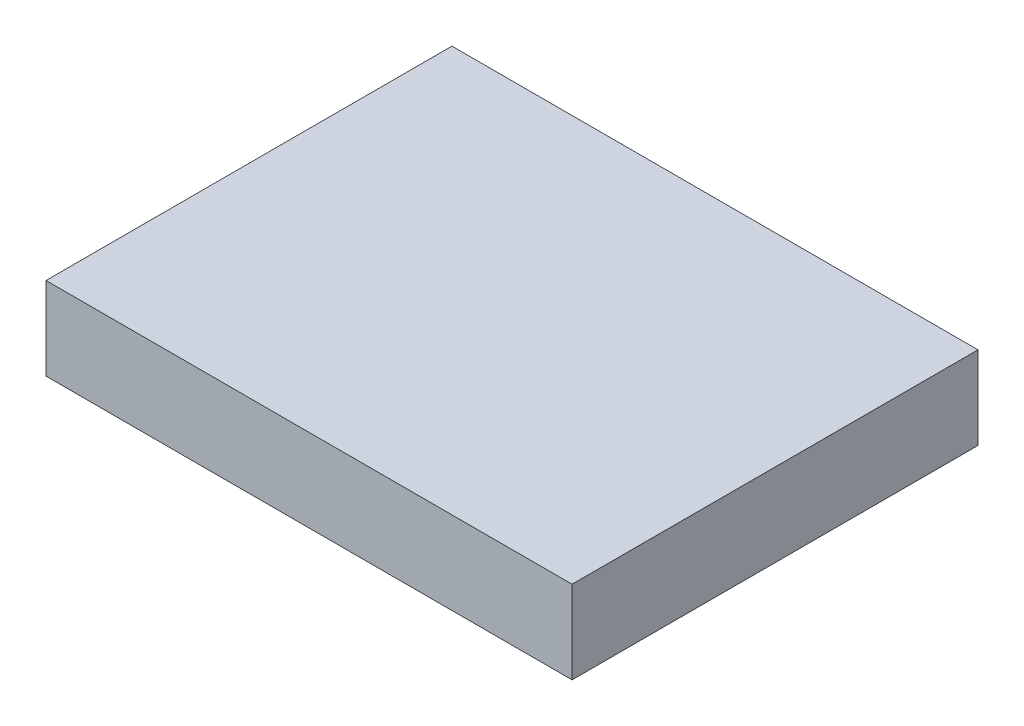
from build123d import *

# Parameters (mm, degrees)
SKETCH_1_W      = 127
SKETCH_1_H      = 98
EXTRUDE_1_DEPTH = 20


with BuildPart() as part:
    # 草图1 → 拉伸1 (new body)
    with BuildSketch(Plane(origin=(0, 0, 0), x_dir=(1, 0, 0), z_dir=(0, 1, 0))):
        Rectangle(SKETCH_1_W, SKETCH_1_H)
    extrude(amount=EXTRUDE_1_DEPTH)


solid = part.part
